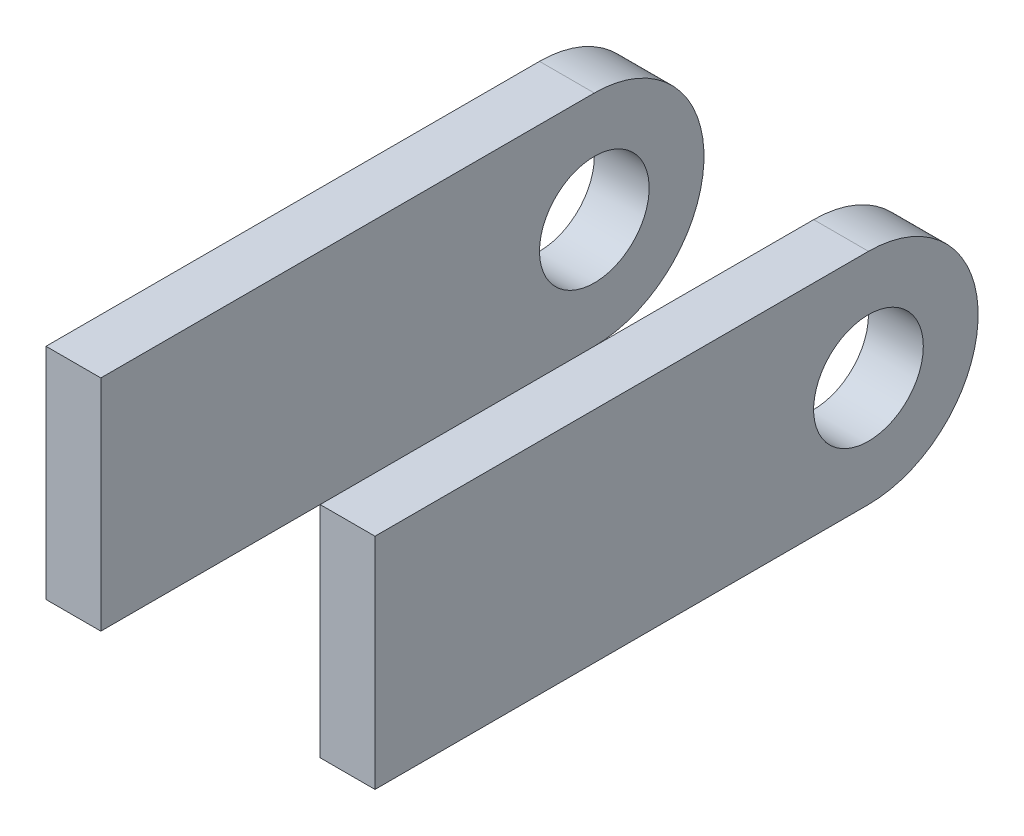
from build123d import *

# Parameters (mm, degrees)
SKETCH1_R           = 5
BOSS_EXTRUDE1_DEPTH = 30
SKETCH2_W           = 20
SKETCH2_H           = 20
CUT_EXTRUDE1_DEPTH  = 65


with BuildPart() as part:
    # Sketch1 → Boss-Extrude1 (new body)
    with BuildSketch(Plane(origin=(0, 0, 0), x_dir=(0, 0, -1), z_dir=(1, 0, 0))):
        with BuildLine():
            Line((0, 10), (-45, 10))
            Line((-45, 10), (-45, -10))
            Line((-45, -10), (0, -10))
            ThreePointArc((0, -10), (10, 0), (0, 10))
        make_face()
        Circle(SKETCH1_R, mode=Mode.SUBTRACT)
    extrude(amount=BOSS_EXTRUDE1_DEPTH)

    # Sketch2 → Cut-Extrude1 (cut)
    with BuildSketch(Plane.XY.offset(45)):
        with Locations((15, 0)):
            Rectangle(SKETCH2_W, SKETCH2_H)
    extrude(amount=-CUT_EXTRUDE1_DEPTH, mode=Mode.SUBTRACT)


with BuildPart() as cut_extrude1_piece_1:
    # of the separate pieces the step leaves, piece 1, a body of its own (cut_extrude1_pieces)
    add(part.part.solids().sort_by_distance((25, 10, 45))[0])


with BuildPart() as cut_extrude1_piece_2:
    # of the separate pieces the step leaves, piece 2, a body of its own (cut_extrude1_pieces)
    add(part.part.solids().sort_by_distance((0, 10, 0))[0])


solid = Compound([cut_extrude1_piece_1.part, cut_extrude1_piece_2.part])
